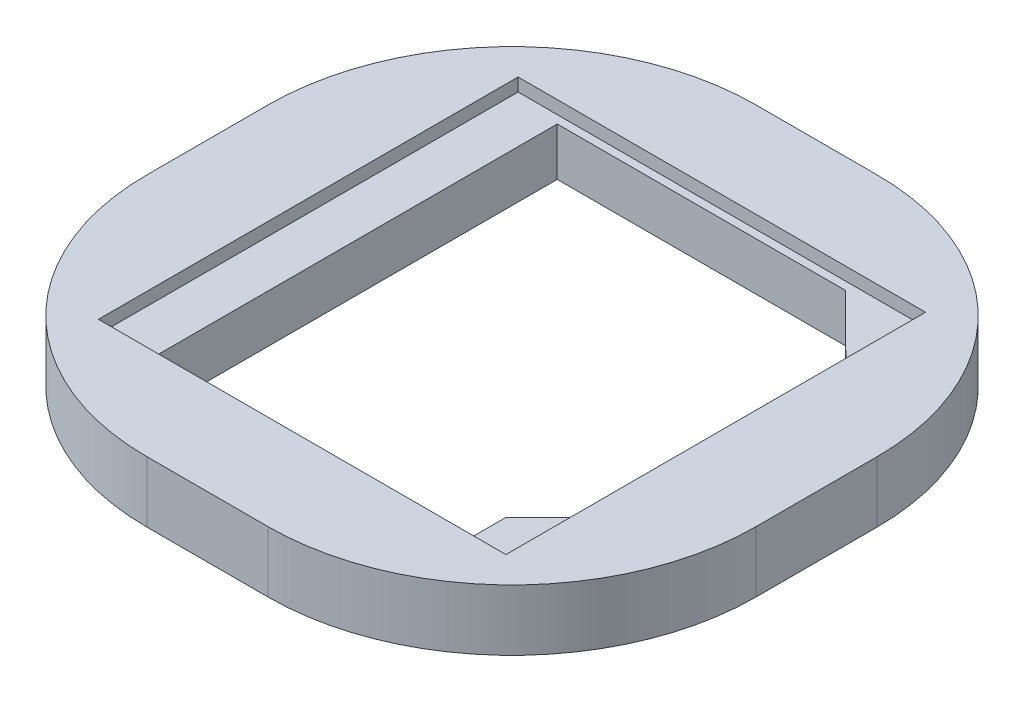
from build123d import *

# Parameters (mm, degrees)
SKETCH2_W          = 74.9
SKETCH2_H          = 74.9
BASE_DEPTH         = 7.5
SKETCH3_W          = 50.1
SKETCH3_H          = 51.6
SLOT_DEPTH         = 1.6
CUT_EXTRUDE2_DEPTH = 5.9
FILLET1_R          = 30


with BuildPart() as part:
    # Sketch2 → Base (new body)
    with BuildSketch(Plane(origin=(0, 0, 0), x_dir=(1, 0, 0), z_dir=(0, 1, 0))):
        Rectangle(SKETCH2_W, SKETCH2_H)
    extrude(amount=BASE_DEPTH)

    # Sketch3 → Slot (cut)
    with BuildSketch(Plane(origin=(0, 7.5, 0), x_dir=(1, 0, 0), z_dir=(0, 1, 0))):
        Rectangle(SKETCH3_W, SKETCH3_H)
    extrude(amount=-SLOT_DEPTH, mode=Mode.SUBTRACT)

    # Sketch4 → Cut-Extrude2 (cut)
    with BuildSketch(Plane(origin=(0, 5.9, 0), x_dir=(1, 0, 0), z_dir=(0, 1, 0))):
        Polygon((-19.238008182, -25.8), (-19.238008182, 24.800726292), (16.199230682, 24.800726292), (25.05, 15.999956974), (25.05, -14.695394427), (19.490907044, -20.286070377), (19.490907044, -25.8), align=None)
    extrude(amount=-CUT_EXTRUDE2_DEPTH, mode=Mode.SUBTRACT)

    # Fillet1
    fillet1_edges = [part.edges().sort_by_distance(p)[0] for p in [
        (37.45, 3.75, 37.45),
        (-37.45, 3.75, 37.45),
        (-37.45, 3.75, -37.45),
        (37.45, 3.75, -37.45),
    ]]
    fillet(fillet1_edges, radius=FILLET1_R)


solid = part.part
